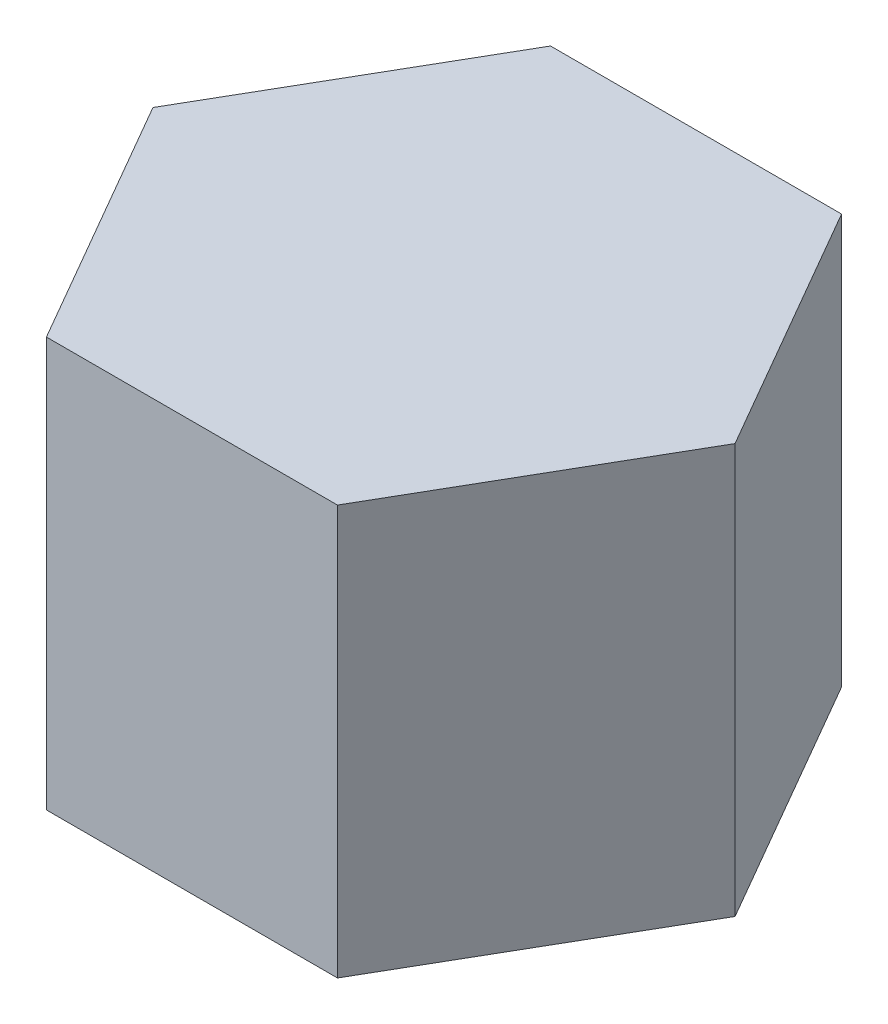
from build123d import *

# Parameters (mm, degrees)
EXTRUDE_1_DEPTH      = 100
EXTRUDE_1_DEPTH_BACK = 30


with BuildPart() as part:
    # 草图1 → 凸台-拉伸1 (new, two sides: drawn at the far end of the back side and taken through both)
    with BuildSketch(Plane(origin=(0, 0, 0), x_dir=(1, 0, 0), z_dir=(0, 1, 0)).offset(-EXTRUDE_1_DEPTH_BACK)):
        Polygon((92.37604307, 0), (46.188021535, 80), (-46.188021535, 80), (-92.37604307, 0), (-46.188021535, -80), (46.188021535, -80), align=None)
    extrude(amount=EXTRUDE_1_DEPTH + EXTRUDE_1_DEPTH_BACK)


solid = part.part
